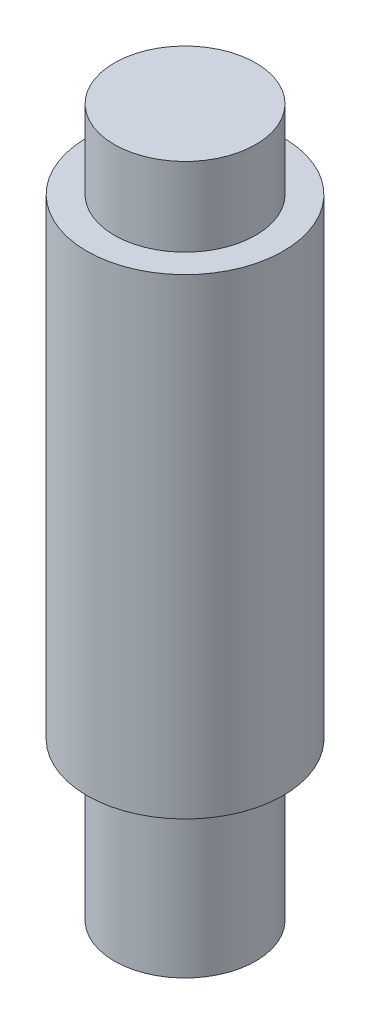
from build123d import *

# Parameters (mm, degrees)
SKETCH_1_R      = 0.9
EXTRUDE_1_DEPTH = 2
SKETCH_2_R      = 1.25
EXTRUDE_2_DEPTH = 6
SKETCH_3_R      = 0.9
EXTRUDE_3_DEPTH = 1


with BuildPart() as part:
    # 草图1 → 凸台-拉伸1 (new body)
    with BuildSketch(Plane(origin=(0, 0, 0), x_dir=(1, 0, 0), z_dir=(0, 1, 0))):
        with Locations(Location((0, 0, 0), (0, 0, 270))):
            Circle(SKETCH_1_R)
    extrude(amount=EXTRUDE_1_DEPTH)

    # 草图2 → 凸台-拉伸2 (add)
    with BuildSketch(Plane(origin=(0, 2, 0), x_dir=(1, 0, 0), z_dir=(0, 1, 0))):
        with Locations(Location((0, 0, 0), (0, 0, 270))):
            Circle(SKETCH_2_R)
    extrude(amount=EXTRUDE_2_DEPTH)

    # 草图3 → 凸台-拉伸3 (add)
    with BuildSketch(Plane(origin=(0, 8, 0), x_dir=(1, 0, 0), z_dir=(0, 1, 0))):
        with Locations(Location((0, 0, 0), (0, 0, 270))):
            Circle(SKETCH_3_R)
    extrude(amount=EXTRUDE_3_DEPTH)


solid = part.part
